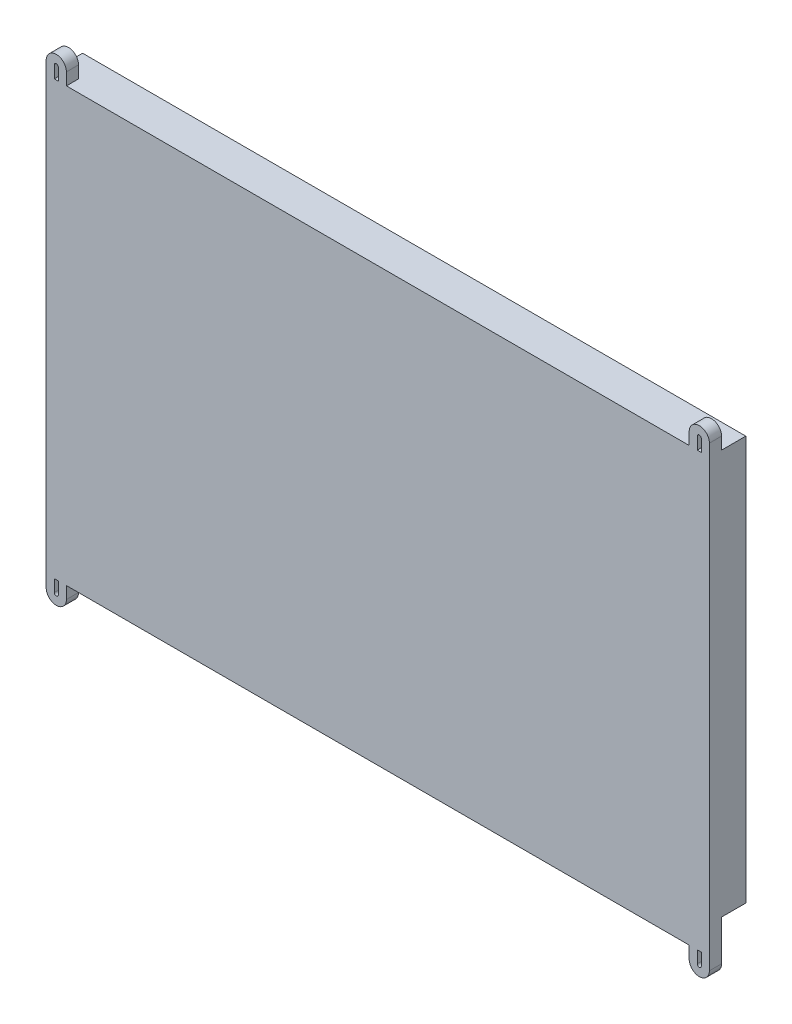
from build123d import *

# Parameters (mm, degrees)
ESBO_O1_W                = 164
ESBO_O1_H                = 100.000000013
RESSALTO_EXTRUS_O1_DEPTH = 6
RESSALTO_EXTRUS_O2_DEPTH = 2.999999997
CORTE_EXTRUS_O1_DEPTH    = 109.258879348
CORTE_EXTRUS_O2_DEPTH    = 109.466515375
ESBO_O5_W                = 153.790549155
ESBO_O5_H                = 89.226156423
CORTE_EXTRUS_O3_DEPTH    = 1


with BuildPart() as part:
    # Esboço1 → Ressalto-extrusão1 (new body)
    with BuildSketch(Plane(origin=(0, 0, -4.5), x_dir=(-1, 0, 0), z_dir=(0, 0, -1))):
        with Locations((7.64158605, 4.901746719)):
            Rectangle(ESBO_O1_W, ESBO_O1_H)
    extrude(amount=-RESSALTO_EXTRUS_O1_DEPTH)

    # Esboço2 → Ressalto-extrusão2 (add)
    with BuildSketch(Plane.XY.offset(1.5)):
        with BuildLine():
            Line((-89.64158605, -55.098253275), (-89.64158605, 57.901746725))
            ThreePointArc((-89.64158605, 57.901746725), (-87.141586045, 60.40174673), (-84.64158604, 57.901746725))
            Line((-84.64158604, 57.901746725), (-84.64158604, 54.901746725))
            Line((-84.64158604, 54.901746725), (69.35841394, 54.901746725))
            Line((69.35841394, 54.901746725), (69.35841394, 57.901746725))
            ThreePointArc((69.35841394, 57.901746725), (71.858413945, 60.40174673), (74.35841395, 57.901746725))
            Line((74.35841395, 57.901746725), (74.35841395, -55.098253275))
            ThreePointArc((74.35841395, -55.098253275), (71.858413945, -57.59825328), (69.35841394, -55.098253275))
            Line((69.35841394, -55.098253275), (69.35841394, -52.098253333))
            Line((69.35841394, -52.098253333), (-84.64158604, -52.098253333))
            Line((-84.64158604, -52.098253333), (-84.64158604, -55.098253275))
            ThreePointArc((-84.64158604, -55.098253275), (-87.141586045, -57.59825328), (-89.64158605, -55.098253275))
        make_face()
        with BuildLine():
            Line((71.358413938, 54.901746725), (72.358413952, 54.901746725))
            Line((72.358413952, 54.901746725), (72.358413952, 57.901746725))
            ThreePointArc((72.358413952, 57.901746725), (71.858413945, 58.401746732), (71.358413938, 57.901746725))
            Line((71.358413938, 57.901746725), (71.358413938, 54.901746725))
        make_face(mode=Mode.SUBTRACT)
        with BuildLine():
            Line((-87.641586042, 54.901746725), (-86.641586048, 54.901746725))
            Line((-86.641586048, 54.901746725), (-86.641586048, 57.901746725))
            ThreePointArc((-86.641586048, 57.901746725), (-87.141586045, 58.401746722), (-87.641586042, 57.901746725))
            Line((-87.641586042, 57.901746725), (-87.641586042, 54.901746725))
        make_face(mode=Mode.SUBTRACT)
    extrude(amount=RESSALTO_EXTRUS_O2_DEPTH)

    # Esboço3 → Corte-extrusão1 (cut, through all)
    with BuildSketch(Plane(origin=(0, 0, 1.5), x_dir=(-1, 0, 0), z_dir=(0, 0, -1))):
        with BuildLine():
            Line((87.641586052, -52.098253275), (86.64158605, -52.098253275))
            Line((86.64158605, -52.098253275), (86.64158605, -55.098253275))
            ThreePointArc((86.64158605, -55.098253275), (87.141586051, -55.598253276), (87.641586052, -55.098253275))
            Line((87.641586052, -55.098253275), (87.641586052, -52.098253275))
        make_face()
    extrude(amount=-CORTE_EXTRUS_O1_DEPTH, mode=Mode.SUBTRACT)

    # Esboço4 → Corte-extrusão2 (cut, through all)
    with BuildSketch(Plane.XY.offset(4.499999997)):
        with BuildLine():
            Line((71.35841395, -52.098253275), (71.35841395, -55.098253275))
            ThreePointArc((71.35841395, -55.098253275), (71.85841395, -55.598253275), (72.35841395, -55.098253275))
            Line((72.35841395, -55.098253275), (72.35841395, -52.098253275))
            Line((72.35841395, -52.098253275), (71.35841395, -52.098253275))
        make_face()
    extrude(amount=-CORTE_EXTRUS_O2_DEPTH, mode=Mode.SUBTRACT)

    # Esboço5 → Corte-extrusão3 (cut)
    with BuildSketch(Plane(origin=(0, 0, -4.5), x_dir=(-1, 0, 0), z_dir=(0, 0, -1))):
        with Locations((6.536860632, 7.288668513)):
            Rectangle(ESBO_O5_W, ESBO_O5_H)
    extrude(amount=-CORTE_EXTRUS_O3_DEPTH, mode=Mode.SUBTRACT)


solid = part.part
